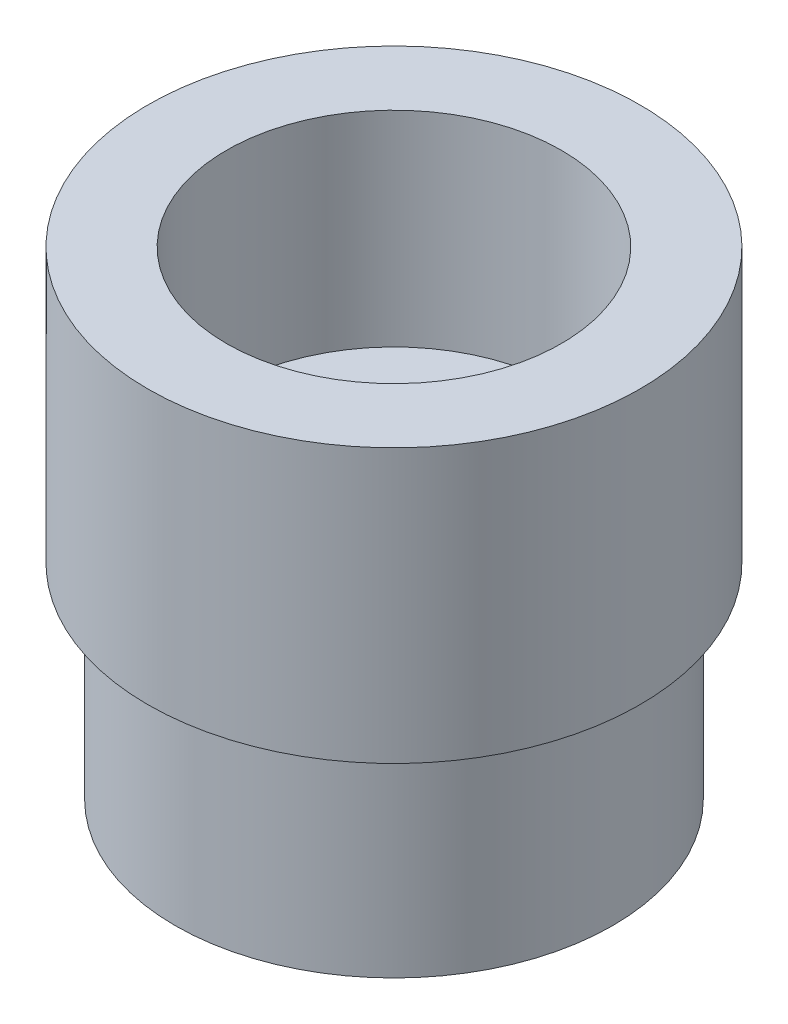
from build123d import *

# Parameters (mm, degrees)
SKETCH1_R           = 4.572
BOSS_EXTRUDE1_DEPTH = 5.08
SKETCH2_R           = 3.1115
CUT_EXTRUDE1_DEPTH  = 3.81
SKETCH3_R           = 4.064
SKETCH3_R_2         = 2.794
EXTRUDE_THIN1_DEPTH = 3.81


with BuildPart() as part:
    # Sketch1 → Boss-Extrude1 (new body)
    with BuildSketch(Plane(origin=(0, 0, 0), x_dir=(1, 0, 0), z_dir=(0, 1, 0))):
        with Locations(Location((0, 0, 0), (0, 0, 270))):
            Circle(SKETCH1_R)
    extrude(amount=BOSS_EXTRUDE1_DEPTH)

    # Sketch2 → Cut-Extrude1 (cut)
    with BuildSketch(Plane(origin=(0, 5.08, 0), x_dir=(1, 0, 0), z_dir=(0, 1, 0))):
        with Locations(Location((0, 0, 0), (0, 0, 270))):
            Circle(SKETCH2_R)
    extrude(amount=-CUT_EXTRUDE1_DEPTH, mode=Mode.SUBTRACT)

    # Sketch3 → Extrude-Thin1 (add)
    with BuildSketch(Plane(origin=(0, 0, 0), x_dir=(-1, 0, 0), z_dir=(0, -1, 0))):
        Circle(SKETCH3_R)
        Circle(SKETCH3_R_2, mode=Mode.SUBTRACT)
    extrude(amount=EXTRUDE_THIN1_DEPTH)


solid = part.part
